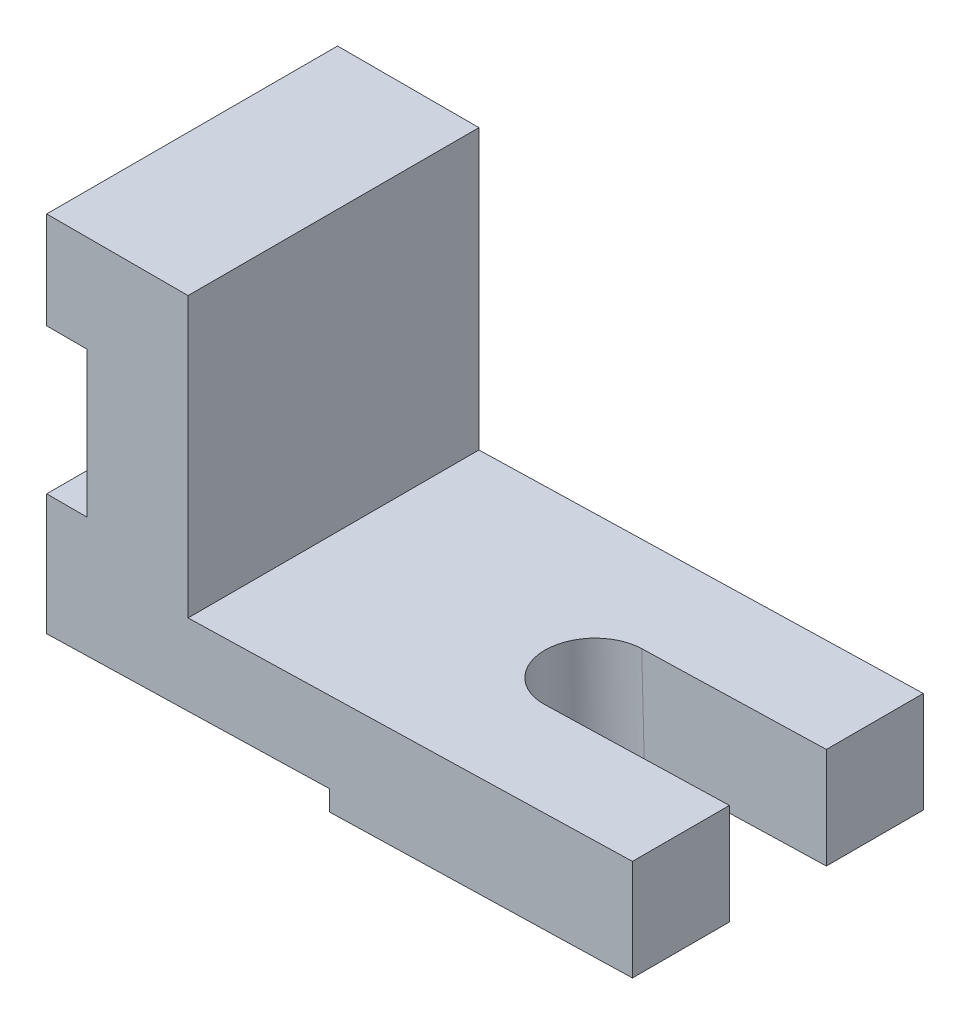
from build123d import *

# Parameters (mm, degrees)
BOSS_EXTRUDE1_DEPTH = 72
SKETCH2_W           = 10
SKETCH2_H           = 36
CUT_EXTRUDE1_DEPTH  = 72
SKETCH3_R           = 12
CUT_EXTRUDE3_DEPTH  = 12
CUT_EXTRUDE4_DEPTH  = 32
SKETCH5_W           = 70.022826976
SKETCH5_H           = 12
BOSS_EXTRUDE2_DEPTH = 5


with BuildPart() as part:
    # Sketch1 → Boss-Extrude1 (new body)
    with BuildSketch(Plane.XY):
        Polygon((0, 0), (70, 1.787819253), (70, -3.212180747), (145, -1.296660118), (145, 23.703339882), (35, 20.893909627), (35, 90), (0, 90), align=None)
    extrude(amount=-BOSS_EXTRUDE1_DEPTH)

    # Sketch2 → Cut-Extrude1 (cut)
    with BuildSketch(Plane.XY):
        with Locations((5, 48)):
            Rectangle(SKETCH2_W, SKETCH2_H)
    extrude(amount=-CUT_EXTRUDE1_DEPTH, mode=Mode.SUBTRACT)

    # Sketch3 → Cut-Extrude3 (cut)
    with BuildSketch(Plane(origin=(0, 0, 0), x_dir=(0, 0, -1), z_dir=(1, 0, 0))):
        with Locations(Location((35.804414242, 47.892382062, 0), (0, 0, 90))):
            Circle(SKETCH3_R)
        with BuildLine():
            Line((59.723322508, 66), (11.885505976, 66))
            ThreePointArc((11.885505976, 66), (35.804414242, 77.892382062), (59.723322508, 66))
        make_face()
        with BuildLine():
            Line((59.88475195, 30), (11.724076534, 30))
            ThreePointArc((11.724076534, 30), (35.804414242, 17.892382062), (59.88475195, 30))
        make_face()
    extrude(amount=CUT_EXTRUDE3_DEPTH, mode=Mode.SUBTRACT)

    # Sketch4 → Cut-Extrude4 (cut)
    with BuildSketch(Plane(origin=(-0.510472517, 19.986962392, 0), x_dir=(0.9996740066520181, 0.025531949089344263, 0), z_dir=(-0.025531949089344263, 0.9996740066520181, 0))):
        with BuildLine():
            Line((99.920378063, 47.920353232), (145.536976224, 47.999981717))
            ThreePointArc((145.536976224, 47.999981717), (157.557905149, 36.020947208), (145.57887064, 24.000018283))
            Line((145.57887064, 24.000018283), (99.962272479, 23.920389797))
            ThreePointArc((99.962272479, 23.920389797), (87.941343554, 35.899424307), (99.920378063, 47.920353232))
        make_face()
    extrude(amount=-CUT_EXTRUDE4_DEPTH, mode=Mode.SUBTRACT)

    # Sketch5 → Boss-Extrude2 (add)
    with BuildSketch(Plane(origin=(0, 0, 0), x_dir=(0.9996740066520181, 0.025531949089344187, 0), z_dir=(0.025531949089344187, -0.9996740066520181, 0))):
        with Locations((35.011413488, -66)):
            Rectangle(SKETCH5_W, SKETCH5_H)
    extrude(amount=BOSS_EXTRUDE2_DEPTH)


solid = part.part
